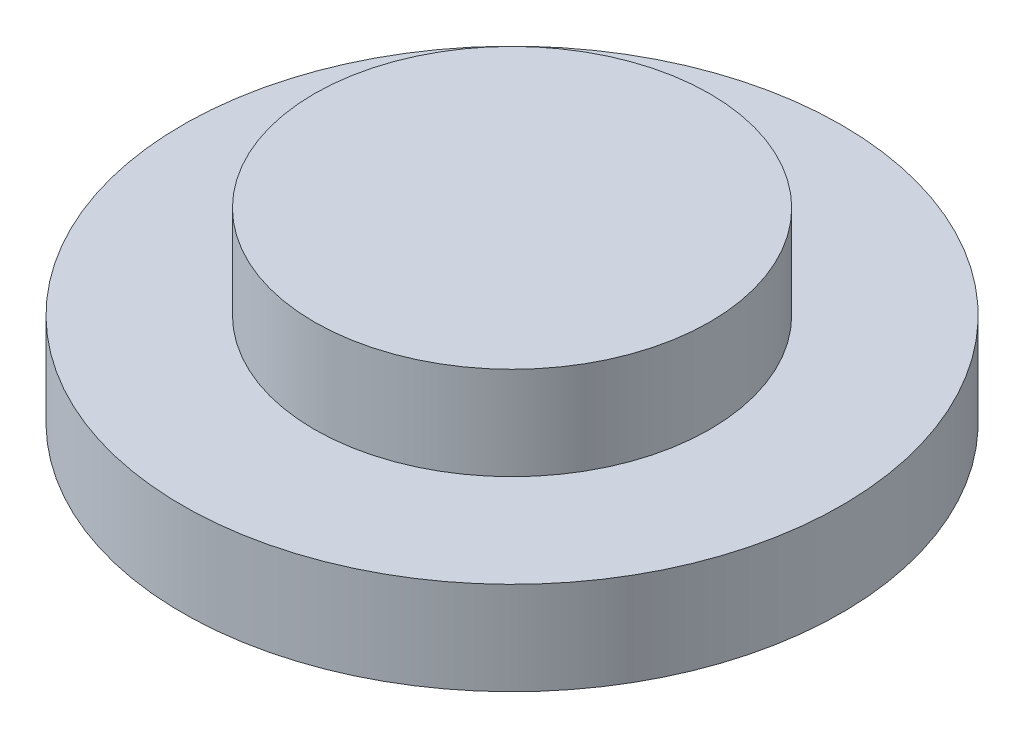
from build123d import *


with BuildPart() as part:
    # Sketch2 → Revolve1 (revolve)
    with BuildSketch(Plane.XY, mode=Mode.PRIVATE) as revolve1_sk:
        Polygon((0, 0), (0, 25.4), (27.000000008, 25.4), (27.000000008, 12.7), (45, 12.7), (45, 0), align=None)
    revolve(revolve1_sk.sketch.rotate(Axis((0, 0, 0), (0, 1, 0)), 90), axis=Axis((0, 0, 0), (0, 1, 0)))


solid = part.part
